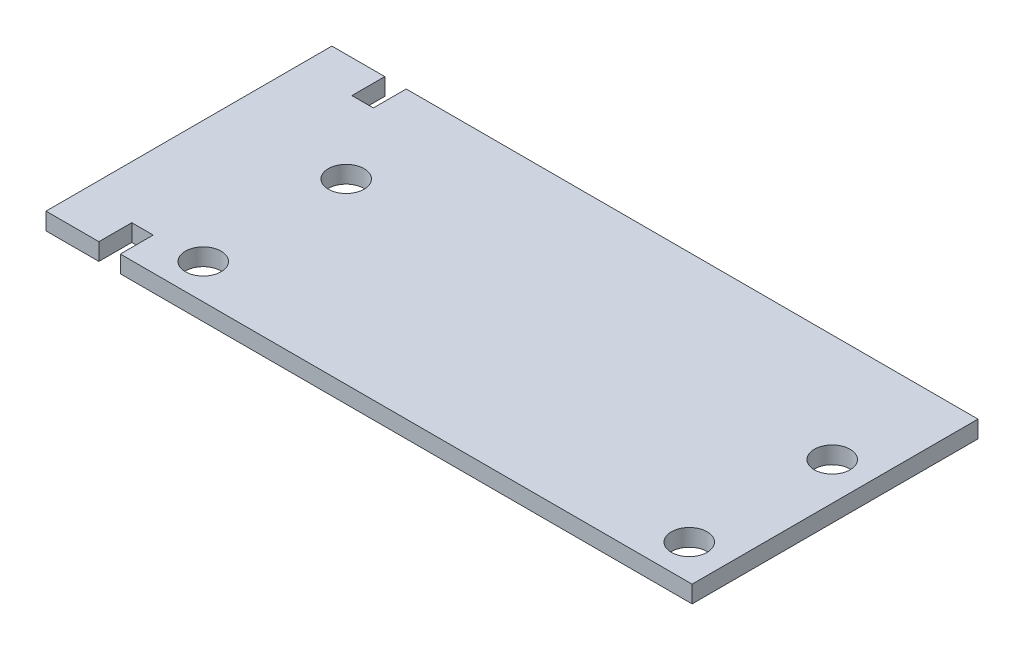
from build123d import *

# Parameters (mm, degrees)
BOSS_EXTRUDE1_DEPTH = 1.2
SKETCH2_R           = 1.25
CUT_EXTRUDE1_DEPTH  = 45.737456343


with BuildPart() as part:
    # Sketch1 → Boss-Extrude1 (new body)
    with BuildSketch(Plane(origin=(0, 0, 0), x_dir=(1, 0, 0), z_dir=(0, 1, 0))):
        Polygon((0, 17.7), (-1.5, 17.7), (-1.5, 20), (-5.2, 20), (-5.2, 0), (-1.5, 0), (-1.5, 2.3), (0, 2.3), (0, 0), (40, 0), (40, 20), (0, 20), align=None)
    extrude(amount=BOSS_EXTRUDE1_DEPTH)

    # Sketch2 → Cut-Extrude1 (cut, through all)
    with BuildSketch(Plane(origin=(0, 1.2, 0), x_dir=(1, 0, 0), z_dir=(0, 1, 0))):
        with Locations(Location((37.35, 2.45, 0), (0, 0, 270))):
            Circle(SKETCH2_R)
        with Locations(Location((37.35, 12.45, 0), (0, 0, 270))):
            Circle(SKETCH2_R)
        with Locations(Location((3.35, 12.45, 0), (0, 0, 270))):
            Circle(SKETCH2_R)
        with Locations(Location((3.35, 2.45, 0), (0, 0, 270))):
            Circle(SKETCH2_R)
    extrude(amount=-CUT_EXTRUDE1_DEPTH, mode=Mode.SUBTRACT)


solid = part.part
